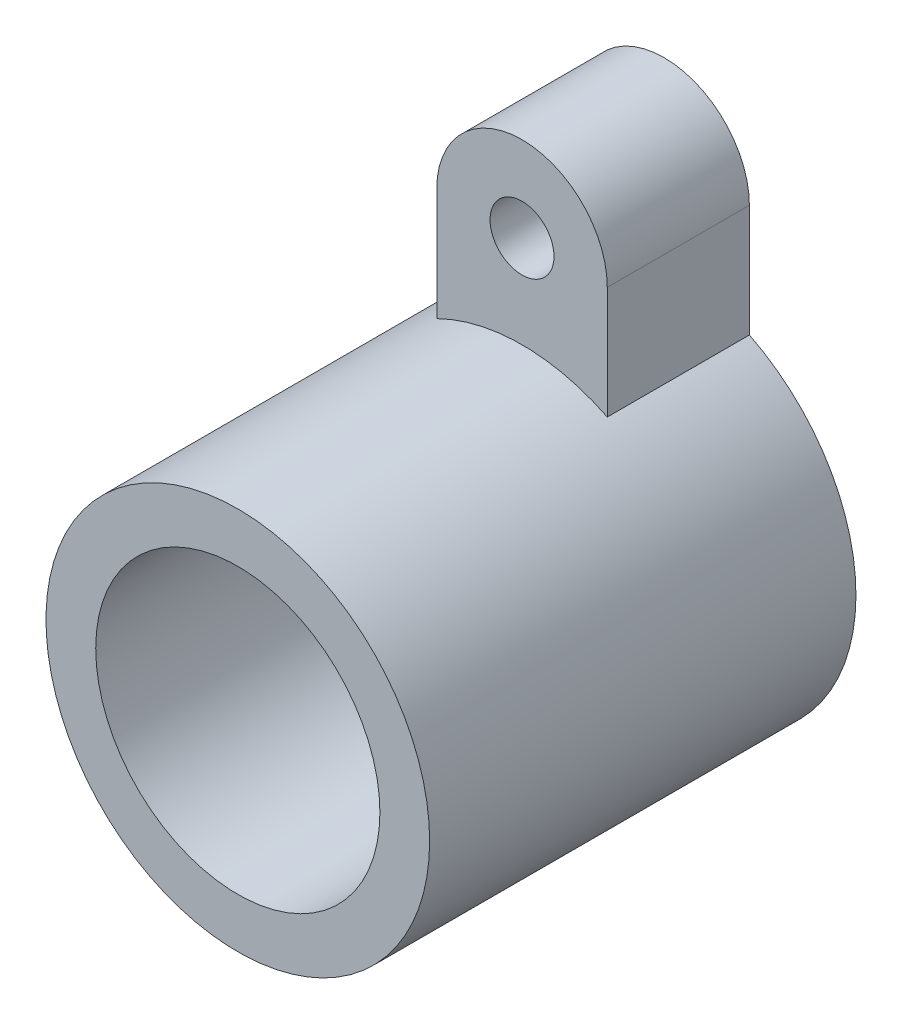
from build123d import *

# Parameters (mm, degrees)
SKETCH_1_R      = 27
SKETCH_1_R_2    = 20
EXTRUDE_1_DEPTH = 60
SKETCH_1_5_R    = 4.5
SKETCH_1_5_R_2  = 4
EXTRUDE_2_DEPTH = 20


with BuildPart() as part:
    # Эскиз1 → Бобышка-Вытянуть1 (new body)
    with BuildSketch(Plane.XY):
        Circle(SKETCH_1_R)
        Circle(SKETCH_1_R_2, mode=Mode.SUBTRACT)
    extrude(amount=EXTRUDE_1_DEPTH)

    # Эскиз1<5> → Бобышка-Вытянуть2 (add)
    # profile 1 of 2: a face of its own
    with BuildSketch(Plane.XY):
        with BuildLine():
            ThreePointArc((-12, 24.186773245), (0, 27), (12, 24.186773245))
            Line((12, 24.186773245), (12, 40))
            ThreePointArc((12, 40), (0, 52), (-12, 40))
            Line((-12, 40), (-12, 24.186773245))
        make_face()
        with Locations((0, 40)):
            Circle(SKETCH_1_5_R, mode=Mode.SUBTRACT)
    # profile 2 of 2: a face of its own
    with BuildSketch(Plane.XY):
        with BuildLine():
            ThreePointArc((-10.663080039, -24.805215663), (-19.091883092, -19.091883092), (-24.805215663, -10.663080039))
            Line((-24.805215663, -10.663080039), (-38.890872965, -24.748737342))
            ThreePointArc((-38.890872965, -24.748737342), (-38.890872965, -38.890872965), (-24.748737342, -38.890872965))
            Line((-24.748737342, -38.890872965), (-10.663080039, -24.805215663))
        make_face()
        with Locations((-31.819805153, -31.819805153)):
            Circle(SKETCH_1_5_R_2, mode=Mode.SUBTRACT)
    extrude(amount=EXTRUDE_2_DEPTH)


solid = part.part
